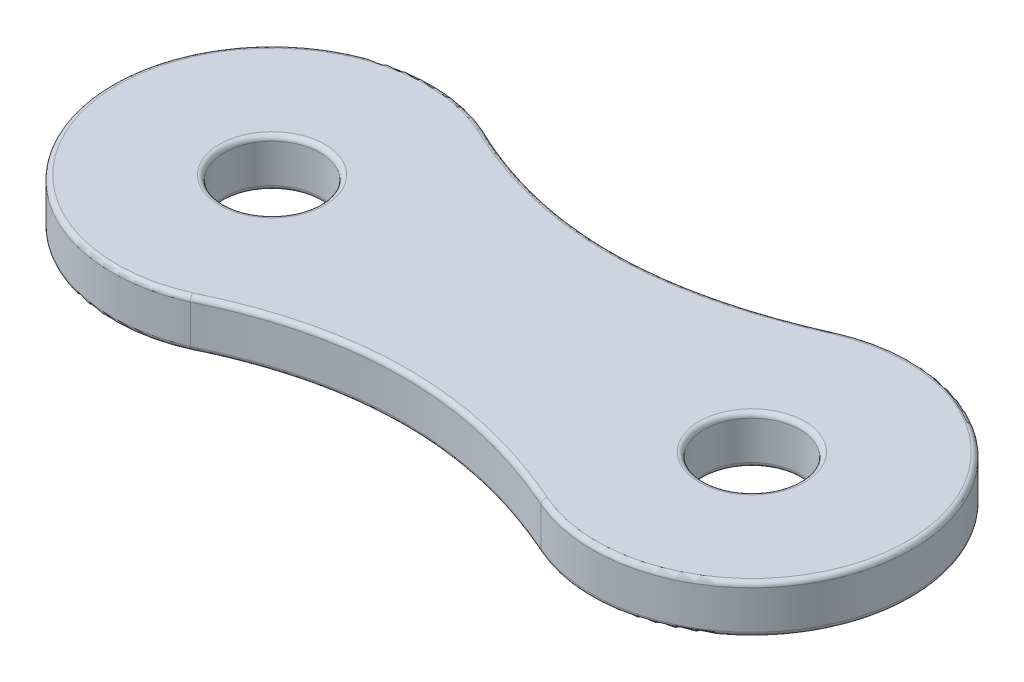
from build123d import *

# Parameters (mm, degrees)
SKETCH2_R           = 0.15
BOSS_EXTRUDE1_DEPTH = 0.15
FILLET1_R           = 0.015


with BuildPart() as part:
    # Sketch2 → Boss-Extrude1 (new body)
    with BuildSketch(Plane(origin=(0, 0, 0), x_dir=(1, 0, 0), z_dir=(0, 1, 0))):
        with BuildLine():
            ThreePointArc((-0.548055874, 0.457404165), (-1.25, 0), (-0.548055874, -0.457404165))
            add(Edge.make_bspline(
                [(-0.548055874, -0.457404165), (-0.160967029, -0.26957617), (0.196289379, -0.302099114), (0.548055874, -0.457404165)],
                knots=[0, 0, 0, 0, 1, 1, 1, 1], degree=3))
            ThreePointArc((0.548055874, -0.457404165), (1.25, 0), (0.548055874, 0.457404165))
            add(Edge.make_bspline(
                [(-0.548055874, 0.457404165), (-0.160967029, 0.26957617), (0.196289379, 0.302099114), (0.548055874, 0.457404165)],
                knots=[0, 0, 0, 0, 1, 1, 1, 1], degree=3))
        make_face()
        with Locations(Location((-0.75, 0, 0), (0, 0, 270))):
            Circle(SKETCH2_R, mode=Mode.SUBTRACT)
        with Locations(Location((0.75, 0, 0), (0, 0, 270))):
            Circle(SKETCH2_R, mode=Mode.SUBTRACT)
    extrude(amount=BOSS_EXTRUDE1_DEPTH)

    # Fillet1
    fillet1_edges = [part.edges().sort_by_distance(p)[0] for p in [
        (-0.000624211, 0.15, -0.32850252),
        (-0.75, 0, -0.15),
        (-0.75, 0.15, -0.15),
        (-1.25, 0.15, 0),
        (0.75, 0, -0.15),
        (0.75, 0.15, -0.15),
        (-0.000624211, 0.15, 0.32850252),
        (-1.25, 0, 0),
        (-0.000624211, 0, -0.32850252),
        (1.25, 0, 0),
        (-0.000624211, 0, 0.32850252),
        (1.25, 0.15, 0),
    ]]
    fillet(fillet1_edges, radius=FILLET1_R)


solid = part.part
